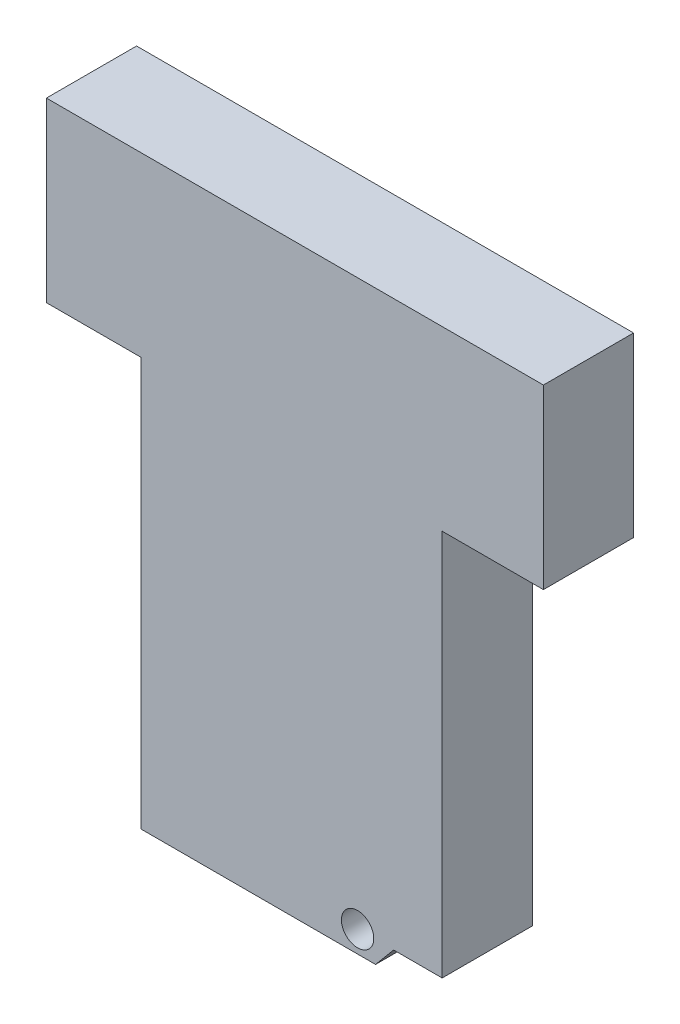
from build123d import *

# Parameters (mm, degrees)
BOSS_EXTRUDE1_DEPTH = 12.7
SKETCH1_9_W         = 14.260820695
SKETCH1_9_H         = 54.5
SKETCH1_9_R         = 2.277625676
CUT_EXTRUDE6_DEPTH  = 12.7


with BuildPart() as part:
    # Sketch1 → Boss-Extrude1 (new body)
    with BuildSketch(Plane.XY):
        Polygon((-70, 3.04), (-59.19389142, 3.04), (-56.643028541, 0), (-23.643028541, 0), (-21.092165662, 3.04), (0, 3.04), (0, 82.5), (-70, 82.5), align=None)
    extrude(amount=BOSS_EXTRUDE1_DEPTH)

    # Sketch1<9> → Cut-Extrude6 (cut)
    with BuildSketch(Plane.XY):
        Polygon((-70, 57.54), (-70, 3.04), (-59.19389142, 3.04), (-56.643028541, 0), (-56.643028541, 57.54), align=None)
        with Locations((-7.130410348, 30.29)):
            Rectangle(SKETCH1_9_W, SKETCH1_9_H)
        with Locations((-26.17389142, 3.04)):
            Circle(SKETCH1_9_R)
    extrude(amount=CUT_EXTRUDE6_DEPTH, mode=Mode.SUBTRACT)


solid = part.part
